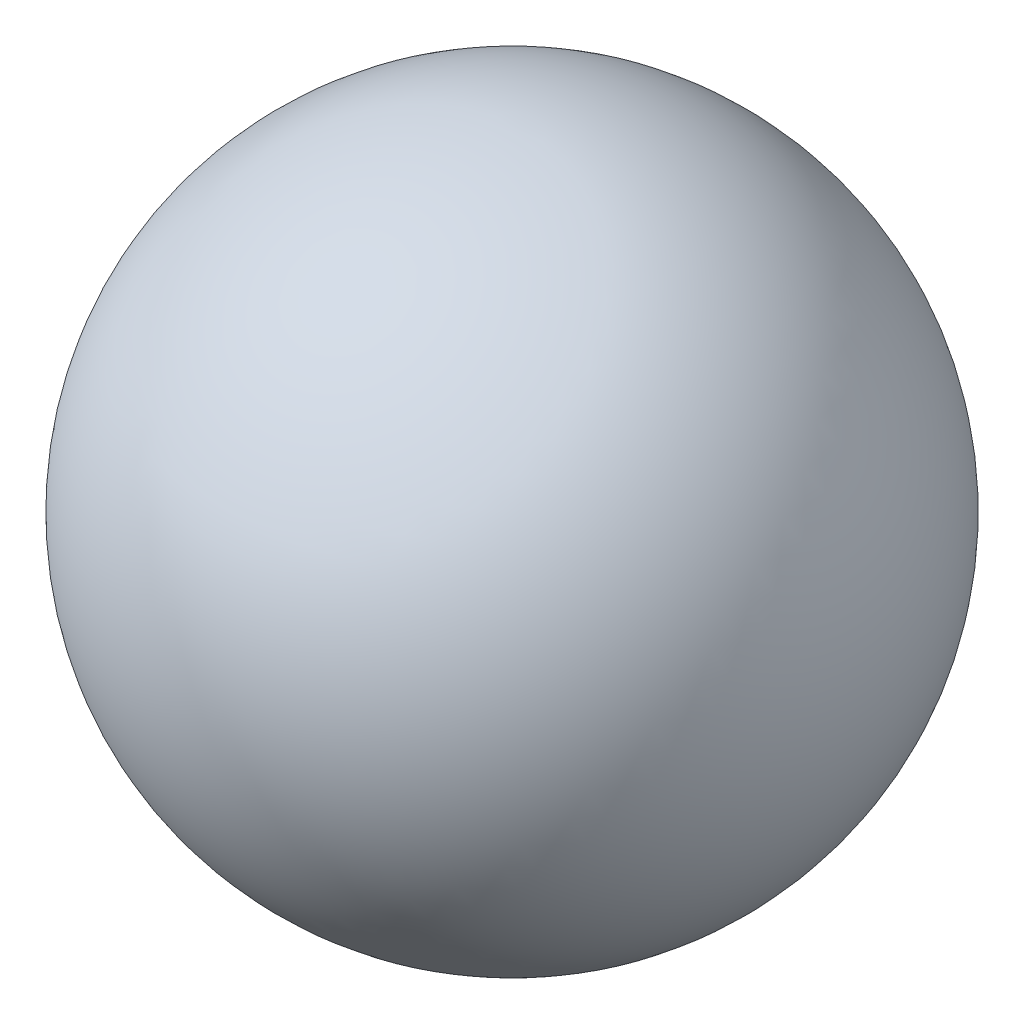
from build123d import *


with BuildPart() as part:
    # Sketch1 → Revolve1 (revolve)
    with BuildSketch(Plane.XY):
        with BuildLine():
            Line((0, 1.75), (0, -1.75))
            ThreePointArc((0, -1.75), (1.75, 0), (0, 1.75))
        make_face()
    revolve(axis=Axis((0, 1.75, 0), (0, -1, 0)))


solid = part.part
